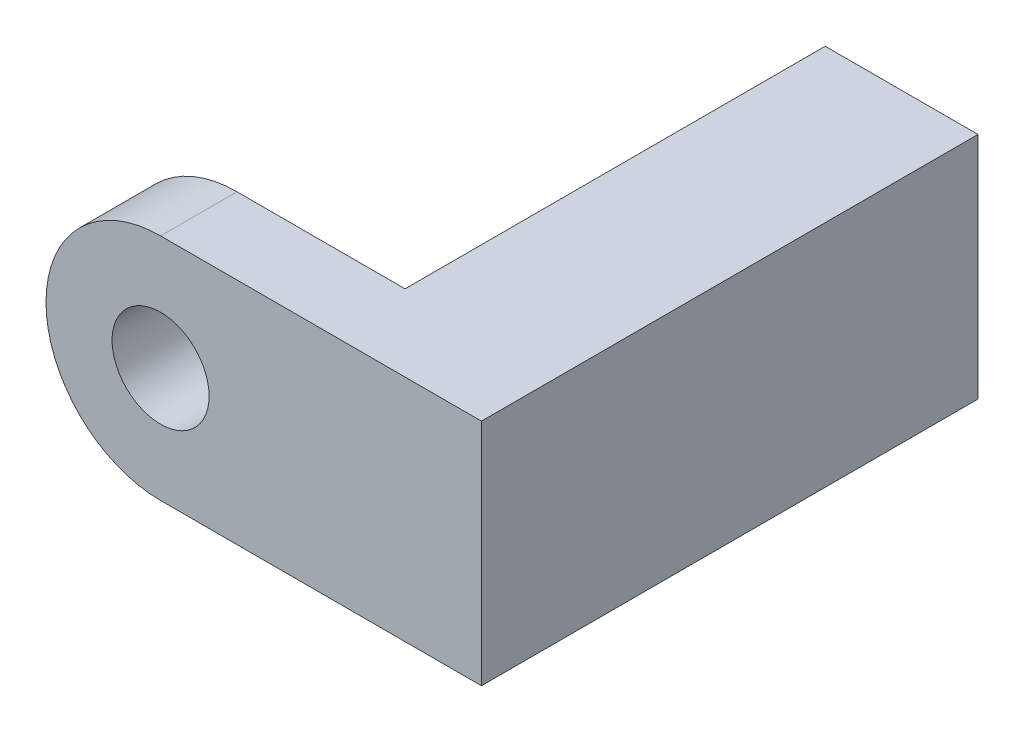
from build123d import *

# Parameters (mm, degrees)
SKETCH1_W           = 20
SKETCH1_H           = 30
BOSS_EXTRUDE1_DEPTH = 55
BOSS_EXTRUDE2_DEPTH = 10
SKETCH3_R           = 6.35
CUT_EXTRUDE1_DEPTH  = 10


with BuildPart() as part:
    # Sketch1 → Boss-Extrude1 (new body)
    with BuildSketch(Plane.XY):
        with Locations((32, 0)):
            Rectangle(SKETCH1_W, SKETCH1_H)
    extrude(amount=BOSS_EXTRUDE1_DEPTH)

    # Sketch2 → Boss-Extrude2 (add)
    with BuildSketch(Plane.XY.offset(55)):
        with BuildLine():
            Line((42, 15), (42, -15))
            Line((42, -15), (0, -15))
            ThreePointArc((0, -15), (-15, 0), (0, 15))
            Line((0, 15), (42, 15))
        make_face()
    extrude(amount=BOSS_EXTRUDE2_DEPTH)

    # Sketch3 → Cut-Extrude1 (cut)
    with BuildSketch(Plane.XY.offset(65)):
        Circle(SKETCH3_R)
    extrude(amount=-CUT_EXTRUDE1_DEPTH, mode=Mode.SUBTRACT)


solid = part.part
